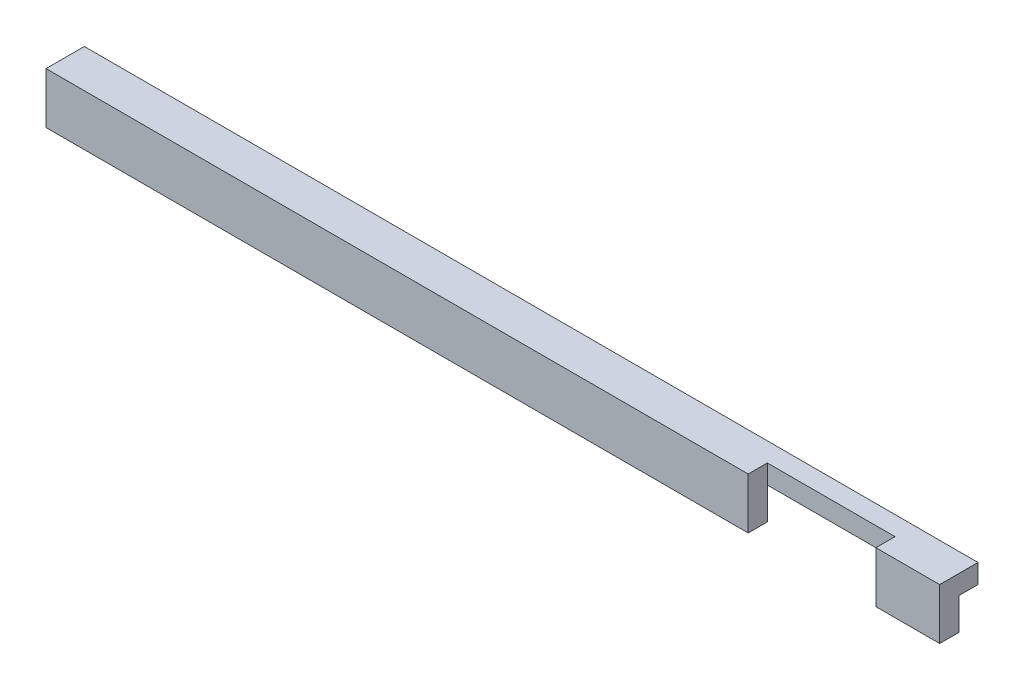
from build123d import *

# Parameters (mm, degrees)
SKETCH1_W           = 140
SKETCH1_H           = 8
BOSS_EXTRUDE1_DEPTH = 8
SKETCH2_W           = 3
SKETCH2_H           = 5
SKETCH2_W_2         = 2
SKETCH2_H_2         = 8
CUT_EXTRUDE1_DEPTH  = 140
SKETCH4_W           = 20
SKETCH4_H           = 8
CUT_EXTRUDE2_DEPTH  = 3


with BuildPart() as part:
    # Sketch1 → Boss-Extrude1 (new body)
    with BuildSketch(Plane(origin=(0, 0, 0), x_dir=(1, 0, 0), z_dir=(0, 1, 0))):
        Rectangle(SKETCH1_W, SKETCH1_H)
    extrude(amount=BOSS_EXTRUDE1_DEPTH)

    # Sketch2 → Cut-Extrude1 (cut)
    with BuildSketch(Plane(origin=(70, 0, 0), x_dir=(0, 0, -1), z_dir=(1, 0, 0))):
        with Locations((2.5, 2.5)):
            Rectangle(SKETCH2_W, SKETCH2_H)
        with Locations((-3, 4)):
            Rectangle(SKETCH2_W_2, SKETCH2_H_2)
    extrude(amount=-CUT_EXTRUDE1_DEPTH, mode=Mode.SUBTRACT)

    # Sketch4 → Cut-Extrude2 (cut)
    with BuildSketch(Plane.XY.offset(2)):
        with Locations((50, 4)):
            Rectangle(SKETCH4_W, SKETCH4_H)
    extrude(amount=-CUT_EXTRUDE2_DEPTH, mode=Mode.SUBTRACT)


solid = part.part
